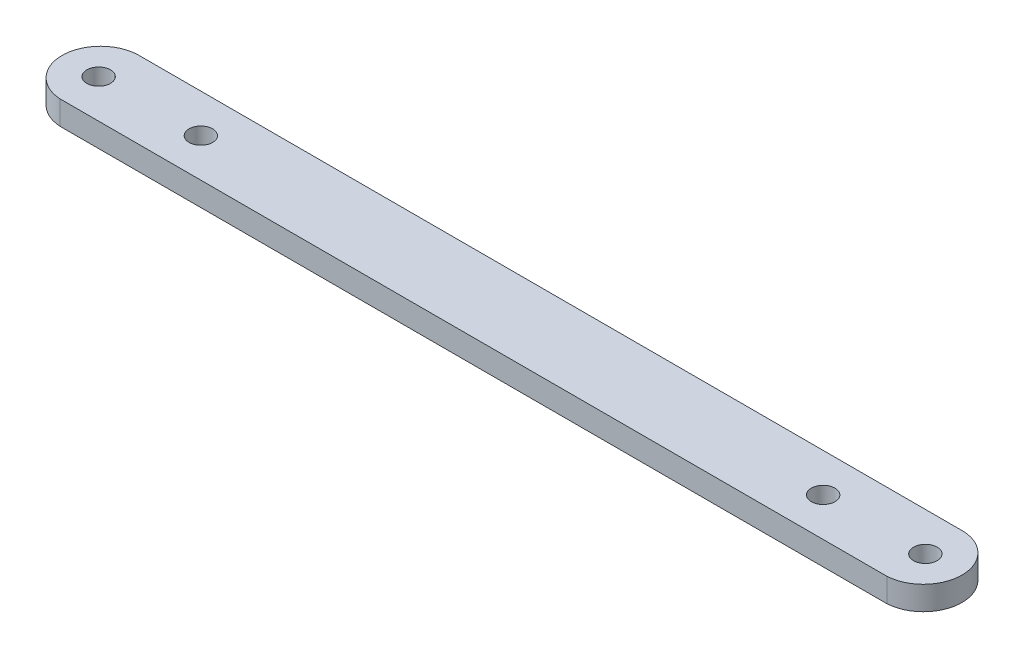
from build123d import *

# Parameters (mm, degrees)
SKETCH1_R           = 1.835
BOSS_EXTRUDE1_DEPTH = 3.7


with BuildPart() as part:
    # Sketch1 → Boss-Extrude1 (new body)
    with BuildSketch(Plane(origin=(0, 0, 0), x_dir=(1, 0, 0), z_dir=(0, 1, 0))):
        with BuildLine():
            Line((-64.3, 6), (64.3, 6))
            ThreePointArc((64.3, 6), (70, 0), (64.3, -6))
            Line((64.3, -6), (-64.3, -6))
            ThreePointArc((-64.3, -6), (-70, 0), (-64.3, 6))
        make_face()
        with Locations(Location((-64.3, 0, 0), (0, 0, 270))):
            Circle(SKETCH1_R, mode=Mode.SUBTRACT)
        with Locations(Location((-48.4, 0, 0), (0, 0, 270))):
            Circle(SKETCH1_R, mode=Mode.SUBTRACT)
        with Locations(Location((64.3, 0, 0), (0, 0, 90))):
            Circle(SKETCH1_R, mode=Mode.SUBTRACT)
        with Locations(Location((48.4, 0, 0), (0, 0, 90))):
            Circle(SKETCH1_R, mode=Mode.SUBTRACT)
    extrude(amount=BOSS_EXTRUDE1_DEPTH)


solid = part.part
